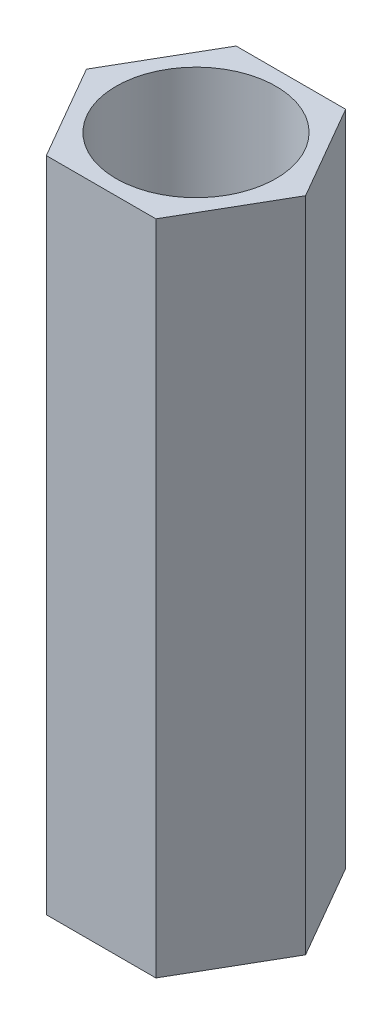
from build123d import *

# Parameters (mm, degrees)
CROQUIS1_R              = 1.825
SALIENTE_EXTRUIR1_DEPTH = 15


with BuildPart() as part:
    # Croquis1 → Saliente-Extruir1 (new body)
    with BuildSketch(Plane(origin=(0, 0, 0), x_dir=(1, 0, 0), z_dir=(0, 1, 0))):
        Polygon((2.5, 0), (1.25, 2.165063509), (-1.25, 2.165063509), (-2.5, 0), (-1.25, -2.165063509), (1.25, -2.165063509), align=None)
        with Locations(Location((0, 0, 0), (0, 0, 270))):
            Circle(CROQUIS1_R, mode=Mode.SUBTRACT)
    extrude(amount=SALIENTE_EXTRUIR1_DEPTH)


solid = part.part
